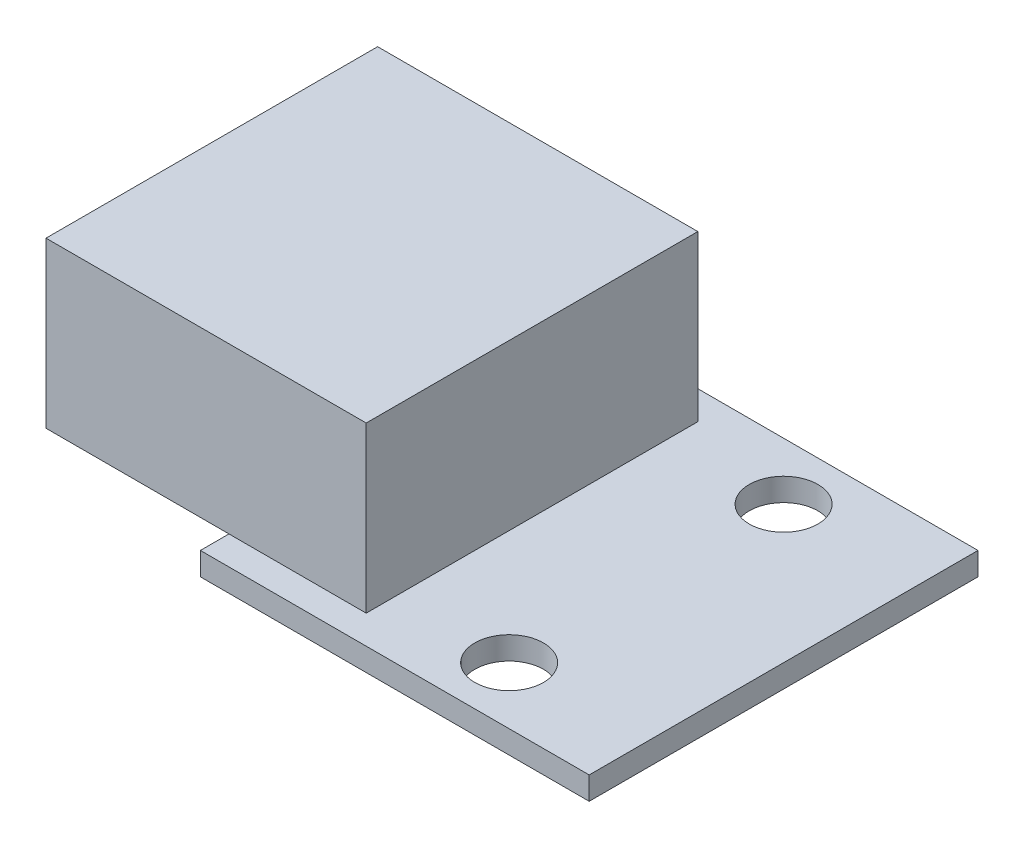
from build123d import *

# Parameters (mm, degrees)
SKETCH1_W           = 17
SKETCH1_H           = 17
SKETCH1_R           = 1.5
BOSS_EXTRUDE1_DEPTH = 1
SKETCH2_W           = 14.5
SKETCH2_H           = 7.2
BOSS_EXTRUDE2_DEPTH = 14
SKETCH3_W           = 12.5
SKETCH3_H           = 5.2
CUT_EXTRUDE1_DEPTH  = 10


with BuildPart() as part:
    # Sketch1 → Boss-Extrude1 (new body)
    with BuildSketch(Plane(origin=(0, 0, 0), x_dir=(1, 0, 0), z_dir=(0, 1, 0))):
        with Locations((-8.5, 8.5)):
            Rectangle(SKETCH1_W, SKETCH1_H)
        with Locations(Location((-6, 14.5, 0), (0, 0, 270))):
            Circle(SKETCH1_R, mode=Mode.SUBTRACT)
        with Locations(Location((-6, 2.5, 0), (0, 0, 270))):
            Circle(SKETCH1_R, mode=Mode.SUBTRACT)
    extrude(amount=BOSS_EXTRUDE1_DEPTH)

    # Sketch2 → Boss-Extrude2 (add)
    with BuildSketch(Plane.ZY.offset(25)):
        with Locations((-8.5, 4.6)):
            Rectangle(SKETCH2_W, SKETCH2_H)
    extrude(amount=-BOSS_EXTRUDE2_DEPTH)

    # Sketch3 → Cut-Extrude1 (cut)
    with BuildSketch(Plane.ZY.offset(25)):
        with Locations((-8.5, 4.6)):
            Rectangle(SKETCH3_W, SKETCH3_H)
    extrude(amount=-CUT_EXTRUDE1_DEPTH, mode=Mode.SUBTRACT)


solid = part.part
